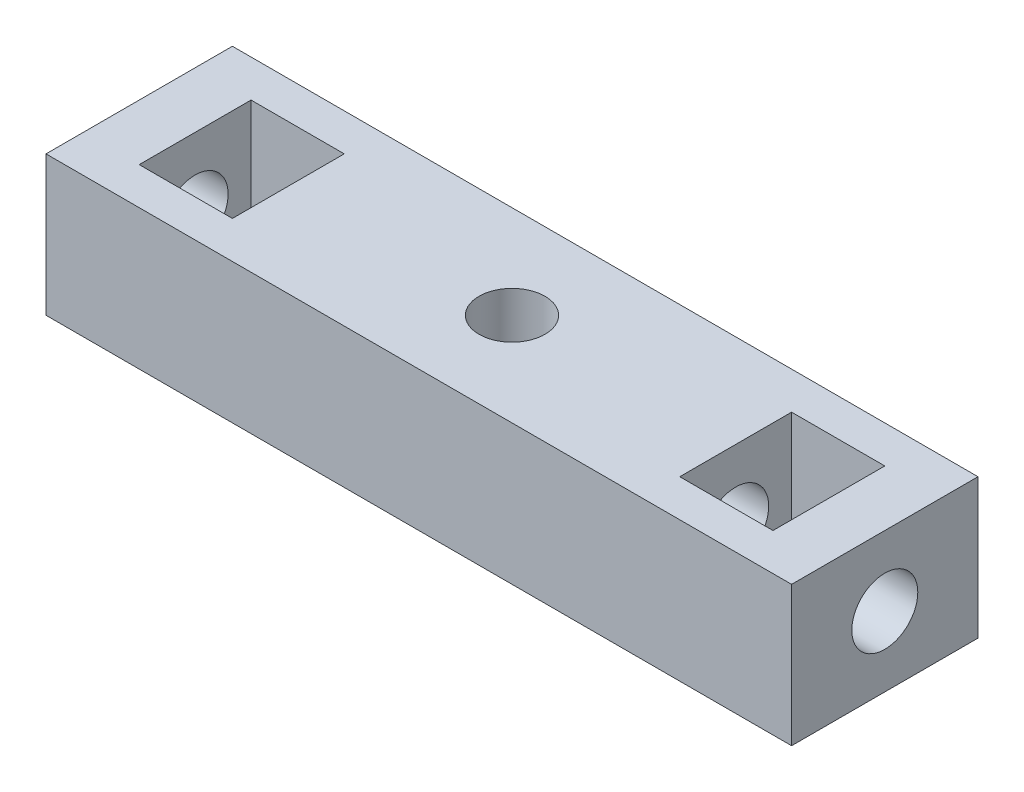
from build123d import *

# Parameters (mm, degrees)
SKETCH1_W                 = 50.8
SKETCH1_H                 = 127
BOSS_EXTRUDE1_DEPTH       = 9.525
SKETCH2_W                 = 50.8
SKETCH2_H                 = 152.4
CUT_EXTRUDE1_DEPTH        = 70.051688068
F_8_CLEARANCE_HOLE1_D     = 4.4958
F_8_CLEARANCE_HOLE2_D     = 4.4958
F_8_CLEARANCE_HOLE2_DEPTH = 13.97
F_8_CLEARANCE_HOLE2_TIP   = 1.350674586
F_8_CLEARANCE_HOLE3_D     = 4.4958
F_8_CLEARANCE_HOLE3_DEPTH = 13.97
F_8_CLEARANCE_HOLE3_TIP   = 1.350674586
SKETCH12_W                = 6.35
SKETCH12_H                = 7.62
CUT_EXTRUDE2_DEPTH        = 70.051688068


with BuildPart() as part:
    # Sketch1 → Boss-Extrude1 (new body)
    with BuildSketch(Plane(origin=(0, 0, 0), x_dir=(1, 0, 0), z_dir=(0, 1, 0))):
        Rectangle(SKETCH1_W, SKETCH1_H)
    extrude(amount=BOSS_EXTRUDE1_DEPTH)

    # Sketch2 → Cut-Extrude1 (cut, through all)
    with BuildSketch(Plane(origin=(0, 9.525, 0), x_dir=(1, 0, 0), z_dir=(0, 1, 0))):
        with Locations((0, -25.4)):
            Rectangle(SKETCH2_W, SKETCH2_H)
    extrude(amount=-CUT_EXTRUDE1_DEPTH, mode=Mode.SUBTRACT)

    # #8 Clearance Hole1 (through all)
    with Locations(Plane(origin=(0, 9.525, 0), x_dir=(1, 0, 0), z_dir=(0, 1, 0))):
        with Locations((0, 57.15)):
            Hole(F_8_CLEARANCE_HOLE1_D / 2)

    # #8 Clearance Hole2
    with Locations(Plane.ZY.offset(25.4)):
        with Locations((-57.15, 4.7625)):
            Hole(F_8_CLEARANCE_HOLE2_D / 2, depth=F_8_CLEARANCE_HOLE2_DEPTH)
            with Locations((0, 0, -(F_8_CLEARANCE_HOLE2_DEPTH + F_8_CLEARANCE_HOLE2_TIP / 2))):  # 118° drill point
                Cone(0, F_8_CLEARANCE_HOLE2_D / 2, F_8_CLEARANCE_HOLE2_TIP, mode=Mode.SUBTRACT)

    # #8 Clearance Hole3
    with Locations(Plane(origin=(25.4, 0, 0), x_dir=(0, 0, -1), z_dir=(1, 0, 0))):
        with Locations((57.15, 4.7625)):
            Hole(F_8_CLEARANCE_HOLE3_D / 2, depth=F_8_CLEARANCE_HOLE3_DEPTH)
            with Locations((0, 0, -(F_8_CLEARANCE_HOLE3_DEPTH + F_8_CLEARANCE_HOLE3_TIP / 2))):  # 118° drill point
                Cone(0, F_8_CLEARANCE_HOLE3_D / 2, F_8_CLEARANCE_HOLE3_TIP, mode=Mode.SUBTRACT)

    # Sketch12 → Cut-Extrude2 (cut, through all)
    with BuildSketch(Plane(origin=(0, 9.525, 0), x_dir=(1, 0, 0), z_dir=(0, 1, 0))):
        with Locations((-18.415, 57.15)):
            Rectangle(SKETCH12_W, SKETCH12_H)
        with Locations((18.415, 57.15)):
            Rectangle(SKETCH12_W, SKETCH12_H)
    extrude(amount=-CUT_EXTRUDE2_DEPTH, mode=Mode.SUBTRACT)


solid = part.part
